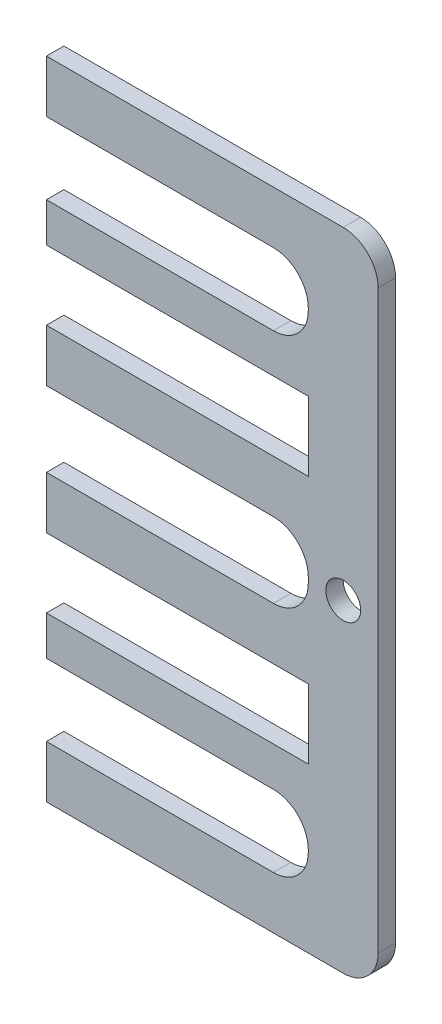
from build123d import *

# Parameters (mm, degrees)
SKETCH_1_R      = 2
EXTRUDE_1_DEPTH = 2
FILLET_1_R      = 4


with BuildPart() as part:
    # ｽｹｯﾁ1 → ﾎﾞｽ - 押し出し1 (new body)
    with BuildSketch(Plane.XY):
        Polygon((-38, -31), (-38, -37), (0, -37), (0, 37), (-38, 37), (-38, 31), (-8, 31), (-8, 22.75), (-38, 22.75), (-38, 18.25), (-8, 18.25), (-8, 10.3), (-38, 10.3), (-38, 4.3), (-8, 4.3), (-8, -4.3), (-38, -4.3), (-38, -10.3), (-8, -10.3), (-8, -18.25), (-38, -18.25), (-38, -22.75), (-8, -22.75), (-8, -31), align=None)
        with Locations((-4, 0)):
            Circle(SKETCH_1_R, mode=Mode.SUBTRACT)
    extrude(amount=EXTRUDE_1_DEPTH)

    # ﾌｨﾚｯﾄ1
    fillet_1_edges = [part.edges().sort_by_distance(p)[0] for p in [
        (-8, -31, 1),
        (-8, -22.75, 1),
        (-8, -4.3, 1),
        (-8, 4.3, 1),
        (-8, 22.75, 1),
        (-8, 31, 1),
        (0, 37, 1),
        (0, -37, 1),
    ]]
    fillet(fillet_1_edges, radius=FILLET_1_R)


solid = part.part
